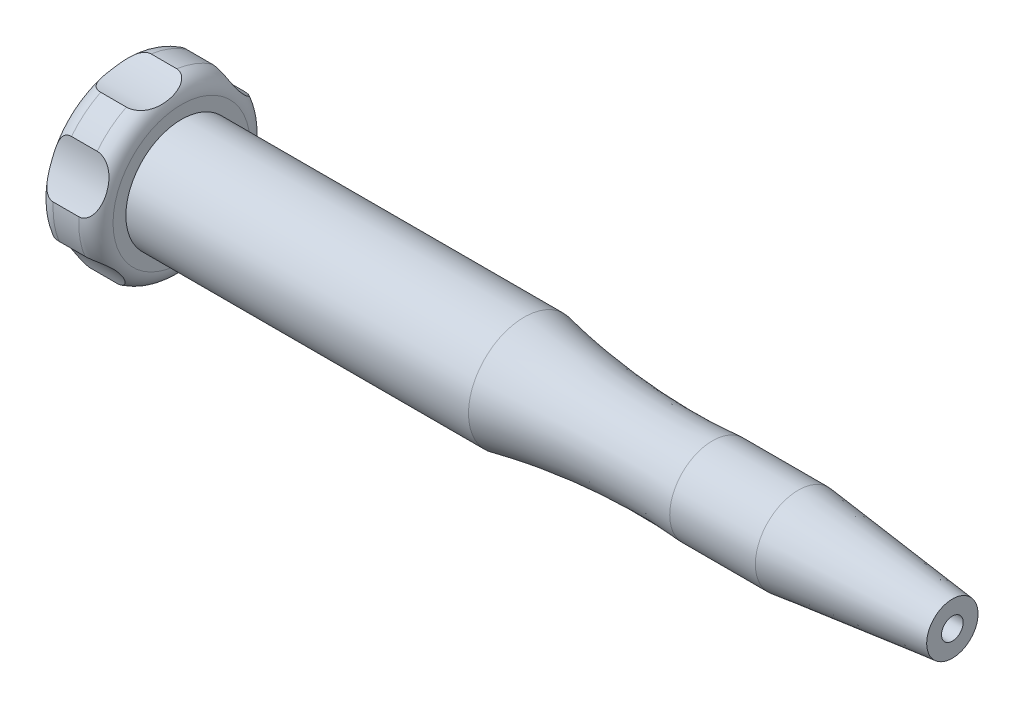
from build123d import *

# Parameters (mm, degrees)
CUT_EXTRUDE1_DEPTH = 14.329999999999998
CUT_EXTRUDE2_START = -14.33
CUT_EXTRUDE2_DEPTH = 3.12
SKETCH3_R          = 8.878997023709873
CUT_EXTRUDE3_DEPTH = 10
CIRPATTERN1_COUNT  = 6


with BuildPart() as part:
    # Sketch1 → Revolve1 (revolve)
    with BuildSketch(Plane.XY, mode=Mode.PRIVATE) as revolve1_sk:
        with BuildLine():
            Line((0, 0), (-50.4860955695321, 0))
            add(Edge.make_bspline(
                [(-52.01874999999999, 7.99999999999998), (-50.16036303063599, 4.2035390390822025), (-50.4860955695321, 0)],
                knots=[0, 0, 0, 1, 1, 1], degree=2))
            ThreePointArc((-52.01874999999999, 7.99999999999998), (-51.43296356237308, 9.414213562373089), (-50.018749999999976, 9.999999999999993))
            Line((-50.018749999999976, 9.999999999999993), (-47.018750000000004, 9.999999999999993))
            ThreePointArc((-47.018750000000004, 9.999999999999993), (-45.6045364376269, 9.414213562373089), (-45.01874999999999, 7.99999999999998))
            Line((-45.01874999999999, 7.99999999999998), (-45.01874999999999, 6.499999999999996))
            Line((-45.01874999999999, 6.499999999999996), (-5.018749999999988, 6.499999999999994))
            add(Edge.make_bspline(
                [(-5.018749999999988, 6.499999999999994), (5.878733880748029, 4.24822033263461), (16.98125000000001, 5.000000000000002)],
                knots=[0, 0, 0, 1, 1, 1], degree=2))
            Line((16.98125000000001, 5.000000000000002), (26.981250000000014, 5.000000000000003))
            Line((26.981250000000014, 5.000000000000003), (44.98125000000002, 3.0000000000000058))
            Line((44.98125000000002, 3.0000000000000058), (44.98125000000002, 5.51e-15))
            Line((44.98125000000002, 5.51e-15), (0, 0))
        make_face()
    revolve(revolve1_sk.sketch.rotate(Axis((-50.4860955695321, 0, 0), (1, 0, 0)), 90), axis=Axis((-50.4860955695321, 0, 0), (1, 0, 0)))

    # Sketch2 → Cut-Extrude1 (cut)
    with BuildSketch(Plane(origin=(44.98125000000002, 0, 0), x_dir=(0, 0, -1), z_dir=(1, 0, 0))):
        with BuildLine():
            ThreePointArc((1.0698598038995577, 0.6749999999999999), (8e-17, 1.265), (-1.0698598038995573, 0.6750000000000003))
            Line((-1.0698598038995575, 0.675), (1.0698598038995575, 0.675))
        make_face()
        with BuildLine():
            Line((1.0698598038995575, -0.675), (-1.0698598038995575, -0.675))
            ThreePointArc((-1.0698598038995577, -0.6749999999999999), (-2.3e-16, -1.265), (1.0698598038995577, -0.6749999999999998))
        make_face()
        with BuildLine():
            ThreePointArc((-1.0698598038995573, 0.6750000000000003), (-1.265, 1.5e-16), (-1.0698598038995577, -0.6749999999999999))
            Line((-1.0698598038995575, -0.675), (1.0698598038995575, -0.675))
            ThreePointArc((1.0698598038995577, -0.6749999999999998), (1.2152361194296644, -0.3513206143019937), (1.265, -3.1e-16))
            ThreePointArc((1.265, 0), (1.2152361194296646, 0.351320614301993), (1.0698598038995577, 0.6749999999999999))
            Line((1.0698598038995575, 0.675), (-1.0698598038995575, 0.675))
        make_face()
    extrude(amount=-CUT_EXTRUDE1_DEPTH, mode=Mode.SUBTRACT)

    # Sketch2<3> → Cut-Extrude2 (cut)
    with BuildSketch(Plane(origin=(44.98125000000002, 0, 0), x_dir=(0, 0, -1), z_dir=(1, 0, 0)).offset(CUT_EXTRUDE2_START)):
        with BuildLine():
            ThreePointArc((-1.0698598038995573, 0.6750000000000003), (-1.265, 1.5e-16), (-1.0698598038995577, -0.6749999999999999))
            Line((-1.0698598038995575, -0.675), (1.0698598038995575, -0.675))
            ThreePointArc((1.0698598038995577, -0.6749999999999998), (1.2152361194296644, -0.3513206143019937), (1.265, -3.1e-16))
            ThreePointArc((1.265, 0), (1.2152361194296646, 0.351320614301993), (1.0698598038995577, 0.6749999999999999))
            Line((1.0698598038995575, 0.675), (-1.0698598038995575, 0.675))
        make_face()
    extrude(amount=-CUT_EXTRUDE2_DEPTH, mode=Mode.SUBTRACT)

    # Sketch3 → Cut-Extrude3 (cut)
    with BuildSketch(Plane(origin=(-45.01874999999999, 0, 0), x_dir=(0, 0, -1), z_dir=(1, 0, 0))):
        with Locations((16.727573230529202, -6.401670880419097)):
            Circle(SKETCH3_R)
    cut_extrude3 = extrude(amount=-CUT_EXTRUDE3_DEPTH, mode=Mode.SUBTRACT)

    # CirPattern1: Cut-Extrude3 ×6 about axis
    cirpattern1_axis = Axis((0, -1.97e-14, 8.2e-15), (1, 0, 0))
    for i in range(1, CIRPATTERN1_COUNT):
        add(cut_extrude3.rotate(cirpattern1_axis, i * 360 / CIRPATTERN1_COUNT), mode=Mode.SUBTRACT)


solid = part.part
